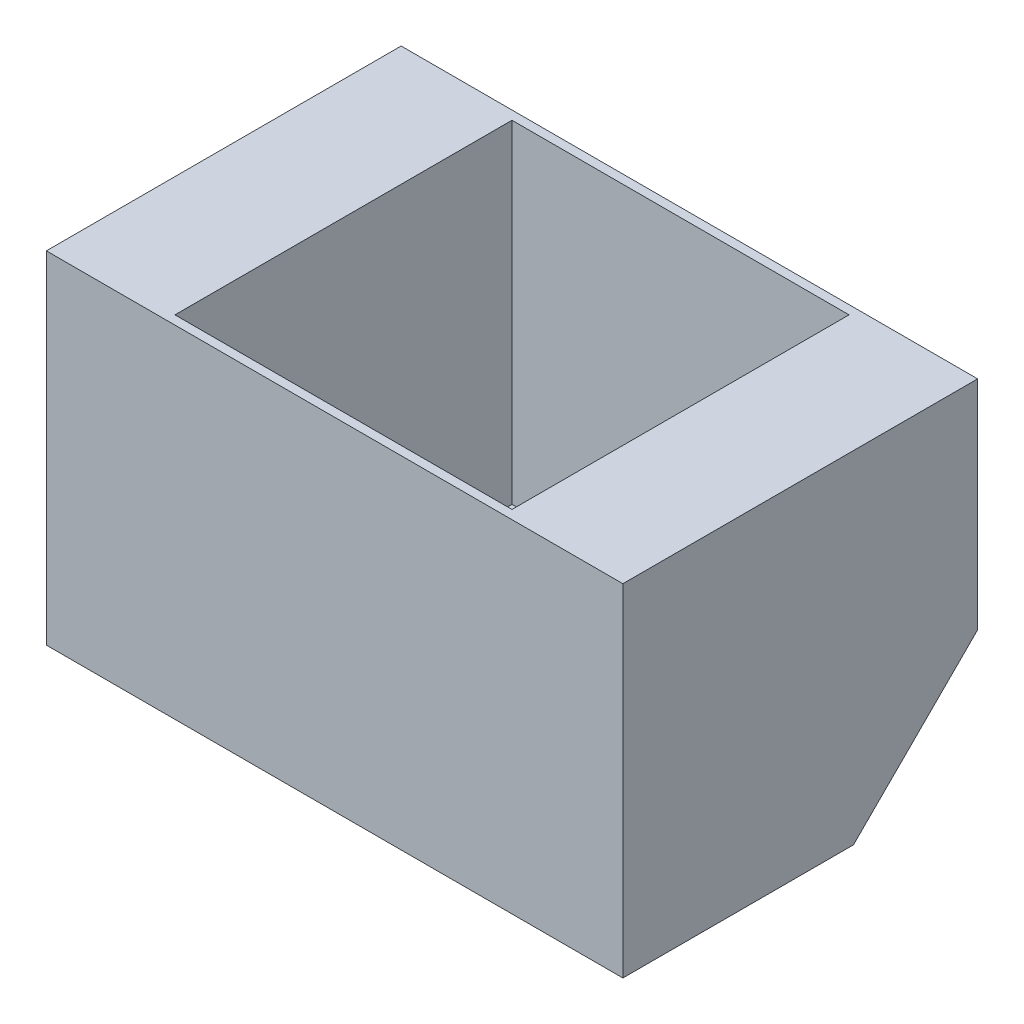
from build123d import *

# Parameters (mm, degrees)
SKETCH1_W               = 80
SKETCH1_H               = 80
SKETCH1_R               = 18.4
BOSS_EXTRUDE1_DEPTH     = 2
SKETCH2_W               = 4
SKETCH2_H               = 18.5
BOSS_EXTRUDE2_DEPTH     = 15.25
SKETCH3_R               = 2.2
CUT_EXTRUDE1_DEPTH      = 94.976393312
MIRROR2_COPY_1_SKETCH_W = 4
MIRROR2_COPY_1_SKETCH_H = 18.5
MIRROR2_COPY_1_DEPTH    = 15.25
MIRROR2_COPY_2_SKETCH_R = 2.2
MIRROR2_COPY_2_DEPTH    = 94.976393312
SKETCH4_R               = 2.2
CUT_EXTRUDE2_DEPTH      = 62.388618652
SKETCH5_W               = 4
SKETCH5_H               = 15.25
CUT_EXTRUDE3_DEPTH      = 93.258129723
SKETCH6_W               = 80
SKETCH6_H               = 80
SKETCH6_W_2             = 76
SKETCH6_H_2             = 76
BOSS_EXTRUDE3_DEPTH     = 75
SKETCH7_W               = 25
SKETCH7_H               = 77
BOSS_EXTRUDE4_DEPTH     = 80
CUT_EXTRUDE5_DEPTH      = 21


with BuildPart() as part:
    # Sketch1 → Boss-Extrude1 (new body)
    with BuildSketch(Plane(origin=(0, 0, 0), x_dir=(1, 0, 0), z_dir=(0, 1, 0))):
        Rectangle(SKETCH1_W, SKETCH1_H)
        with Locations(Location((0, 0, 0), (0, 0, 270))):
            Circle(SKETCH1_R, mode=Mode.SUBTRACT)
    extrude(amount=BOSS_EXTRUDE1_DEPTH)

    # Sketch2 → Boss-Extrude2 (add)
    with BuildSketch(Plane(origin=(0, 2, 0), x_dir=(1, 0, 0), z_dir=(0, 1, 0))):
        with Locations((42, -30.75)):
            Rectangle(SKETCH2_W, SKETCH2_H)
    boss_extrude2 = extrude(amount=-BOSS_EXTRUDE2_DEPTH)

    # Sketch3 → Cut-Extrude1 (cut, through all)
    with BuildSketch(Plane(origin=(44, 0, 0), x_dir=(0, 0, -1), z_dir=(1, 0, 0))):
        with Locations((-30.75, -8.125)):
            Circle(SKETCH3_R)
    cut_extrude1 = extrude(amount=-CUT_EXTRUDE1_DEPTH, mode=Mode.SUBTRACT)

    # Mirror1: Boss-Extrude2, Cut-Extrude1 across plane
    add(boss_extrude2.mirror(Plane(origin=(0, 0, 0), x_dir=(0, 0, 1), z_dir=(1, 0, 0))))
    add(cut_extrude1.mirror(Plane(origin=(0, 0, 0), x_dir=(0, 0, 1), z_dir=(1, 0, 0))), mode=Mode.SUBTRACT)

    # Mirror2: Boss-Extrude2, Cut-Extrude1 across plane
    add(boss_extrude2.mirror(Plane(origin=(0, 0, 0), x_dir=(1, 0, 0), z_dir=(0, 0, -1))))
    add(cut_extrude1.mirror(Plane(origin=(0, 0, 0), x_dir=(1, 0, 0), z_dir=(0, 0, -1))), mode=Mode.SUBTRACT)

    # Mirror2 copy 1 sketch → Mirror2 copy 1 (add)
    with BuildSketch(Plane(origin=(0, 2, 0), x_dir=(-1, 0, 0), z_dir=(0, 1, 0))):
        with Locations((42, -30.75)):
            Rectangle(MIRROR2_COPY_1_SKETCH_W, MIRROR2_COPY_1_SKETCH_H)
    extrude(amount=-MIRROR2_COPY_1_DEPTH)

    # Mirror2 copy 2 sketch → Mirror2 copy 2 (cut, through all)
    with BuildSketch(Plane.ZY.offset(44)):
        with Locations((-30.75, -8.125)):
            Circle(MIRROR2_COPY_2_SKETCH_R)
    extrude(amount=-MIRROR2_COPY_2_DEPTH, mode=Mode.SUBTRACT)

    # Sketch4 → Cut-Extrude2 (cut, through all)
    with BuildSketch(Plane(origin=(0, 2, 0), x_dir=(1, 0, 0), z_dir=(0, 1, 0))):
        with Locations(Location((-24, 24, 0), (0, 0, 270))):
            Circle(SKETCH4_R)
        with Locations(Location((24, 24, 0), (0, 0, 270))):
            Circle(SKETCH4_R)
    cut_extrude2 = extrude(amount=-CUT_EXTRUDE2_DEPTH, mode=Mode.SUBTRACT)

    # Mirror3: Cut-Extrude2 across plane
    add(cut_extrude2.mirror(Plane(origin=(0, 0, 0), x_dir=(1, 0, 0), z_dir=(0, 0, -1))), mode=Mode.SUBTRACT)

    # Sketch5 → Cut-Extrude3 (cut, through all)
    with BuildSketch(Plane.XY.offset(40)):
        with Locations((-42, -5.625)):
            Rectangle(SKETCH5_W, SKETCH5_H)
        with Locations((42, -5.625)):
            Rectangle(SKETCH5_W, SKETCH5_H)
    extrude(amount=-CUT_EXTRUDE3_DEPTH, mode=Mode.SUBTRACT)

    # Sketch6 → Boss-Extrude3 (add)
    with BuildSketch(Plane(origin=(0, 2, 0), x_dir=(1, 0, 0), z_dir=(0, 1, 0))):
        Rectangle(SKETCH6_W, SKETCH6_H)
        Rectangle(SKETCH6_W_2, SKETCH6_H_2, mode=Mode.SUBTRACT)
    extrude(amount=BOSS_EXTRUDE3_DEPTH)

    # Sketch7 → Boss-Extrude4 (add)
    with BuildSketch(Plane.XY.offset(40)):
        with Locations((-52.5, 38.5)):
            Rectangle(SKETCH7_W, SKETCH7_H)
        with Locations((52.5, 38.5)):
            Rectangle(SKETCH7_W, SKETCH7_H)
    extrude(amount=-BOSS_EXTRUDE4_DEPTH)

    # Sketch9 → Cut-Extrude5 (cut)
    with BuildSketch(Plane(origin=(65, 0, 0), x_dir=(0, 0, -1), z_dir=(1, 0, 0))):
        Polygon((40, 0), (40, 28), (12, 0), align=None)
    cut_extrude5 = extrude(amount=-CUT_EXTRUDE5_DEPTH, mode=Mode.SUBTRACT)

    # Mirror4: Cut-Extrude5 across plane
    add(cut_extrude5.mirror(Plane(origin=(0, 0, 0), x_dir=(0, 0, 1), z_dir=(1, 0, 0))), mode=Mode.SUBTRACT)


solid = part.part
